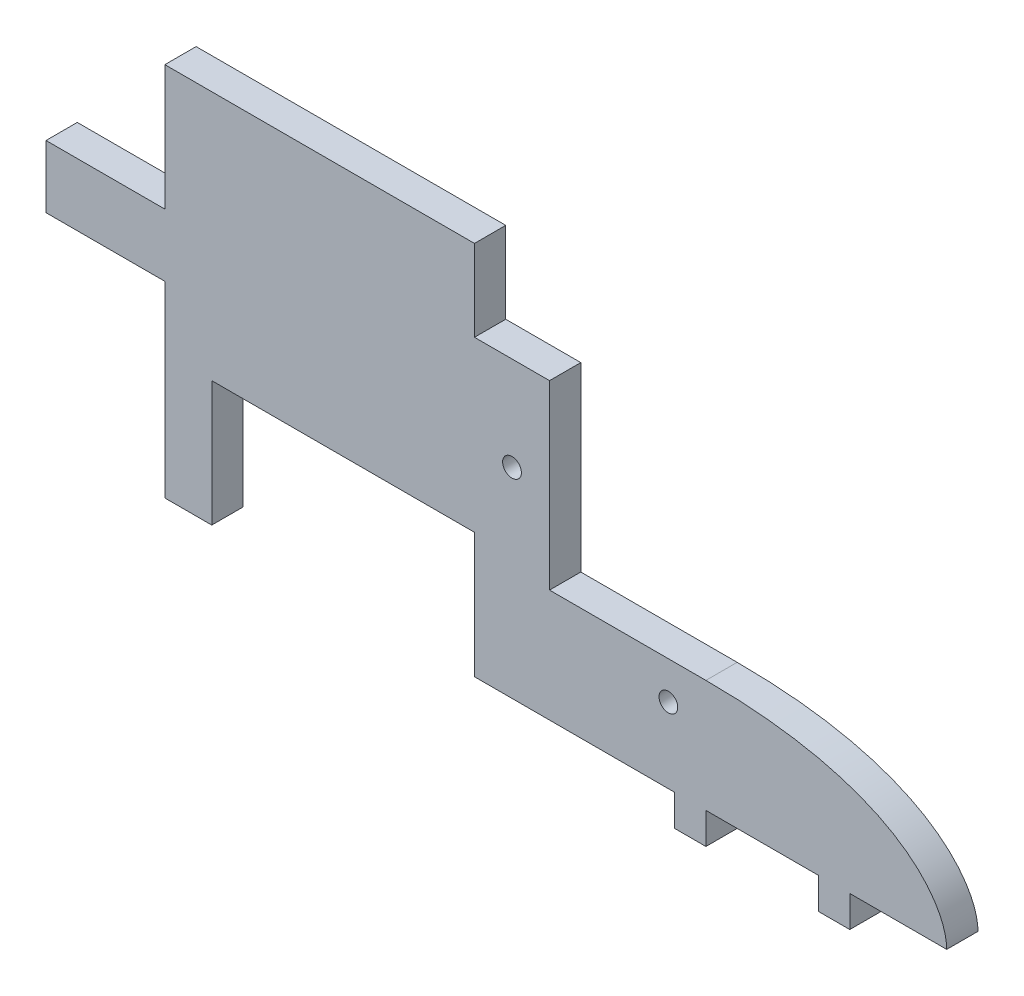
from build123d import *

# Parameters (mm, degrees)
ESQUISSE1_R             = 1.5
BOSS_EXTRU_1_DEPTH      = 5
BOSS_EXTRU_2_DEPTH      = 5
ESQUISSE3_W             = 236.288260714
ESQUISSE3_H             = 122.224262112
ENL_V_MAT_EXTRU_1_DEPTH = 5


with BuildPart() as part:
    # Esquisse1 → Boss.-Extru.1 (new body)
    with BuildSketch(Plane.XY):
        Polygon((0, 0), (32, 0), (32, -5), (37, -5), (37, 0), (37, 18), (12, 18), (12, 47), (0, 47), align=None)
        with Locations((6, 32)):
            Circle(ESQUISSE1_R, mode=Mode.SUBTRACT)
        with Locations((31, 12)):
            Circle(ESQUISSE1_R, mode=Mode.SUBTRACT)
    extrude(amount=BOSS_EXTRU_1_DEPTH)

    # Esquisse2 → Boss.-Extru.2 (add)
    with BuildSketch(Plane(origin=(0, 0, 0), x_dir=(-1, 0, 0), z_dir=(0, 0, -1))):
        with BuildLine():
            Line((-37, 0), (-55, 0))
            Line((-55, 0), (-55, -5))
            Line((-55, -5), (-60, -5))
            Line((-60, -5), (-60, 0))
            Line((-60, 0), (-75.5, 0))
            add(Edge.make_bspline(
                [(-75.5, 0), (-75.5, 5.982232529), (-67.685409636, 18), (-37, 18)],
                knots=[0, 0, 0, 0, 1, 1, 1, 1], degree=3))
            Line((-37, 18), (-37, 0))
        make_face()
        Polygon((42, 0), (49.5, 0), (49.5, 30), (68.5, 30), (68.5, 40), (49.5, 40), (49.5, 110), (68.5, 110), (68.5, 120), (49.5, 120), (49.5, 142), (-1, 142), (-1, 167), (-10, 167), (-10, 172), (-20, 172), (-20, 167), (-25, 167), (-25, 90), (20, 90), (20, 60), (0, 60), (0, 20), (42, 20), align=None)
    extrude(amount=-BOSS_EXTRU_2_DEPTH)

    # Esquisse3 → Enlèv. mat.-Extru.1 (cut)
    with BuildSketch(Plane(origin=(0, 0, 0), x_dir=(-1, 0, 0), z_dir=(0, 0, -1))):
        with Locations((68.98963671, 121.112131056)):
            Rectangle(ESQUISSE3_W, ESQUISSE3_H)
    extrude(amount=-ENL_V_MAT_EXTRU_1_DEPTH, mode=Mode.SUBTRACT)


solid = part.part
